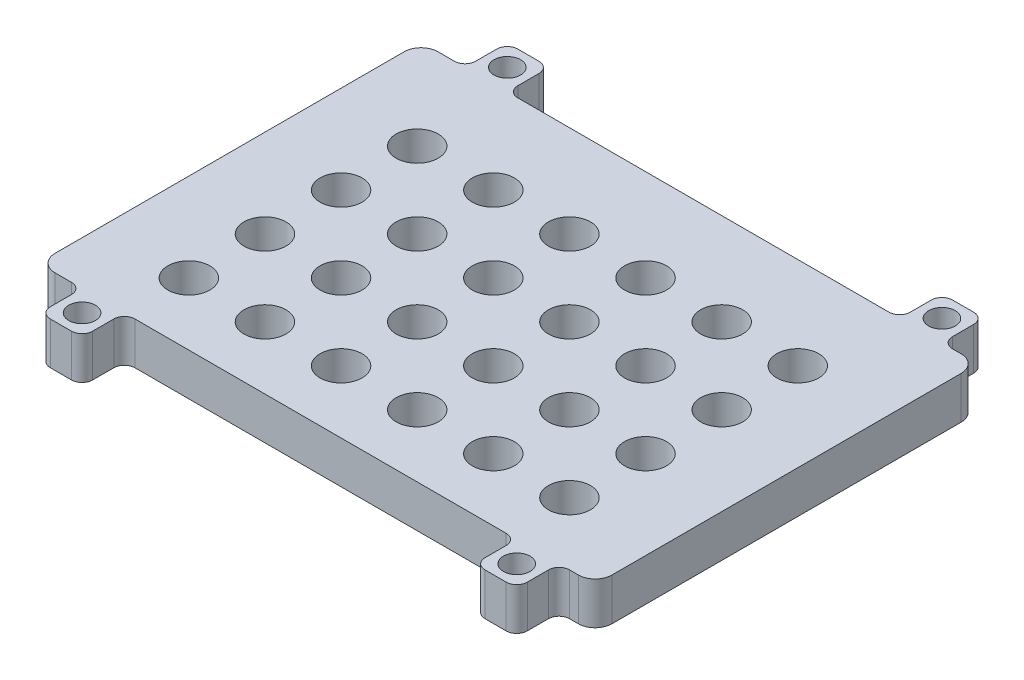
from build123d import *

# Parameters (mm, degrees)
SKETCH1_W           = 131.727
SKETCH1_H           = 90.551
SKETCH1_R           = 3.5
BOSS_EXTRUDE1_DEPTH = 10
SKETCH3_W           = 10
SKETCH3_H           = 10
BOSS_EXTRUDE3_DEPTH = 10
SKETCH4_R           = 3.15
CUT_EXTRUDE2_DEPTH  = 87.564320205
FILLET2_R           = 2.5
FILLET3_R           = 4
SKETCH5_R           = 4.975
CUT_EXTRUDE3_DEPTH  = 9.5


with BuildPart() as part:
    # Sketch1 → Boss-Extrude1 (new body)
    with BuildSketch(Plane(origin=(0, 0, 0), x_dir=(1, 0, 0), z_dir=(0, 1, 0))):
        Rectangle(SKETCH1_W, SKETCH1_H)
        with Locations(Location((-45, 23.5, 0), (0, 0, 270))):
            Circle(SKETCH1_R, mode=Mode.SUBTRACT)
        with Locations(Location((-27, 23.5, 0), (0, 0, 270))):
            Circle(SKETCH1_R, mode=Mode.SUBTRACT)
        with Locations(Location((-9, 23.5, 0), (0, 0, 270))):
            Circle(SKETCH1_R, mode=Mode.SUBTRACT)
        with Locations(Location((9, 23.5, 0), (0, 0, 270))):
            Circle(SKETCH1_R, mode=Mode.SUBTRACT)
        with Locations(Location((27, 23.5, 0), (0, 0, 270))):
            Circle(SKETCH1_R, mode=Mode.SUBTRACT)
        with Locations(Location((45, 23.5, 0), (0, 0, 270))):
            Circle(SKETCH1_R, mode=Mode.SUBTRACT)
        with Locations(Location((-27, 5.5, 0), (0, 0, 270))):
            Circle(SKETCH1_R, mode=Mode.SUBTRACT)
        with Locations(Location((-9, 5.5, 0), (0, 0, 270))):
            Circle(SKETCH1_R, mode=Mode.SUBTRACT)
        with Locations(Location((9, 5.5, 0), (0, 0, 270))):
            Circle(SKETCH1_R, mode=Mode.SUBTRACT)
        with Locations(Location((27, 5.5, 0), (0, 0, 270))):
            Circle(SKETCH1_R, mode=Mode.SUBTRACT)
        with Locations(Location((45, 5.5, 0), (0, 0, 270))):
            Circle(SKETCH1_R, mode=Mode.SUBTRACT)
        with Locations(Location((-27, -12.5, 0), (0, 0, 270))):
            Circle(SKETCH1_R, mode=Mode.SUBTRACT)
        with Locations(Location((-9, -12.5, 0), (0, 0, 270))):
            Circle(SKETCH1_R, mode=Mode.SUBTRACT)
        with Locations(Location((9, -12.5, 0), (0, 0, 270))):
            Circle(SKETCH1_R, mode=Mode.SUBTRACT)
        with Locations(Location((27, -12.5, 0), (0, 0, 270))):
            Circle(SKETCH1_R, mode=Mode.SUBTRACT)
        with Locations(Location((45, -12.5, 0), (0, 0, 270))):
            Circle(SKETCH1_R, mode=Mode.SUBTRACT)
        with Locations(Location((-27, -30.5, 0), (0, 0, 270))):
            Circle(SKETCH1_R, mode=Mode.SUBTRACT)
        with Locations(Location((-9, -30.5, 0), (0, 0, 270))):
            Circle(SKETCH1_R, mode=Mode.SUBTRACT)
        with Locations(Location((9, -30.5, 0), (0, 0, 270))):
            Circle(SKETCH1_R, mode=Mode.SUBTRACT)
        with Locations(Location((27, -30.5, 0), (0, 0, 270))):
            Circle(SKETCH1_R, mode=Mode.SUBTRACT)
        with Locations(Location((45, -30.5, 0), (0, 0, 270))):
            Circle(SKETCH1_R, mode=Mode.SUBTRACT)
        with Locations(Location((-45, 5.5, 0), (0, 0, 270))):
            Circle(SKETCH1_R, mode=Mode.SUBTRACT)
        with Locations(Location((-45, -12.5, 0), (0, 0, 270))):
            Circle(SKETCH1_R, mode=Mode.SUBTRACT)
        with Locations(Location((-45, -30.5, 0), (0, 0, 270))):
            Circle(SKETCH1_R, mode=Mode.SUBTRACT)
    extrude(amount=BOSS_EXTRUDE1_DEPTH)

    # Sketch3 → Boss-Extrude3 (add)
    with BuildSketch(Plane.XZ):
        with Locations((52.3134, -50.2755)):
            Rectangle(SKETCH3_W, SKETCH3_H)
        with Locations((-50.47267, -50.2755)):
            Rectangle(SKETCH3_W, SKETCH3_H)
        with Locations((-50.47267, 50.2755)):
            Rectangle(SKETCH3_W, SKETCH3_H)
        with Locations((52.3134, 50.2755)):
            Rectangle(SKETCH3_W, SKETCH3_H)
    extrude(amount=-BOSS_EXTRUDE3_DEPTH)

    # Sketch4 → Cut-Extrude2 (cut, through all)
    with BuildSketch(Plane(origin=(0, 0, 0), x_dir=(-1, 0, 0), z_dir=(0, -1, 0))):
        with Locations(Location((-52.3134, -50.2755, 0), (0, 0, 90))):
            Circle(SKETCH4_R)
        with Locations(Location((50.47267, -50.2755, 0), (0, 0, 90))):
            Circle(SKETCH4_R)
        with Locations(Location((50.47267, 50.2755, 0), (0, 0, 90))):
            Circle(SKETCH4_R)
        with Locations(Location((-52.3134, 50.2755, 0), (0, 0, 90))):
            Circle(SKETCH4_R)
    extrude(amount=-CUT_EXTRUDE2_DEPTH, mode=Mode.SUBTRACT)

    # Fillet2
    fillet2_edges = [part.edges().sort_by_distance(p)[0] for p in [
        (47.3134, 5, 55.2755),
        (47.3134, 5, 45.2755),
        (57.3134, 5, 55.2755),
        (57.3134, 5, 45.2755),
        (-45.47267, 5, 55.2755),
        (-45.47267, 5, 45.2755),
        (-55.47267, 5, 55.2755),
        (-55.47267, 5, 45.2755),
        (-45.47267, 5, -45.2755),
        (-45.47267, 5, -55.2755),
        (-55.47267, 5, -45.2755),
        (-55.47267, 5, -55.2755),
        (47.3134, 5, -45.2755),
        (47.3134, 5, -55.2755),
        (57.3134, 5, -45.2755),
        (57.3134, 5, -55.2755),
    ]]
    fillet(fillet2_edges, radius=FILLET2_R)

    # Fillet3
    fillet3_edges = [part.edges().sort_by_distance(p)[0] for p in [
        (-65.8635, 5, -45.2755),
        (-65.8635, 5, 45.2755),
        (65.8635, 5, 45.2755),
        (65.8635, 5, -45.2755),
    ]]
    fillet(fillet3_edges, radius=FILLET3_R)

    # Sketch5 → Cut-Extrude3 (cut)
    with BuildSketch(Plane(origin=(0, 10, 0), x_dir=(1, 0, 0), z_dir=(0, 1, 0))):
        with Locations(Location((45, -30.5, 0), (0, 0, 270))):
            Circle(SKETCH5_R)
        with Locations(Location((27, -30.5, 0), (0, 0, 270))):
            Circle(SKETCH5_R)
        with Locations(Location((9, -30.5, 0), (0, 0, 270))):
            Circle(SKETCH5_R)
        with Locations(Location((-9, -30.5, 0), (0, 0, 270))):
            Circle(SKETCH5_R)
        with Locations(Location((-27, -30.5, 0), (0, 0, 270))):
            Circle(SKETCH5_R)
        with Locations(Location((-45, -30.5, 0), (0, 0, 270))):
            Circle(SKETCH5_R)
        with Locations(Location((45, -12.5, 0), (0, 0, 270))):
            Circle(SKETCH5_R)
        with Locations(Location((27, -12.5, 0), (0, 0, 270))):
            Circle(SKETCH5_R)
        with Locations(Location((9, -12.5, 0), (0, 0, 270))):
            Circle(SKETCH5_R)
        with Locations(Location((-9, -12.5, 0), (0, 0, 270))):
            Circle(SKETCH5_R)
        with Locations(Location((-27, -12.5, 0), (0, 0, 270))):
            Circle(SKETCH5_R)
        with Locations(Location((-45, -12.5, 0), (0, 0, 270))):
            Circle(SKETCH5_R)
        with Locations(Location((45, 5.5, 0), (0, 0, 270))):
            Circle(SKETCH5_R)
        with Locations(Location((27, 5.5, 0), (0, 0, 270))):
            Circle(SKETCH5_R)
        with Locations(Location((9, 5.5, 0), (0, 0, 270))):
            Circle(SKETCH5_R)
        with Locations(Location((-9, 5.5, 0), (0, 0, 270))):
            Circle(SKETCH5_R)
        with Locations(Location((-27, 5.5, 0), (0, 0, 270))):
            Circle(SKETCH5_R)
        with Locations(Location((-45, 5.5, 0), (0, 0, 270))):
            Circle(SKETCH5_R)
        with Locations(Location((45, 23.5, 0), (0, 0, 270))):
            Circle(SKETCH5_R)
        with Locations(Location((27, 23.5, 0), (0, 0, 270))):
            Circle(SKETCH5_R)
        with Locations(Location((9, 23.5, 0), (0, 0, 270))):
            Circle(SKETCH5_R)
        with Locations(Location((-9, 23.5, 0), (0, 0, 270))):
            Circle(SKETCH5_R)
        with Locations(Location((-27, 23.5, 0), (0, 0, 270))):
            Circle(SKETCH5_R)
        with Locations(Location((-45, 23.5, 0), (0, 0, 270))):
            Circle(SKETCH5_R)
    extrude(amount=-CUT_EXTRUDE3_DEPTH, mode=Mode.SUBTRACT)


solid = part.part
